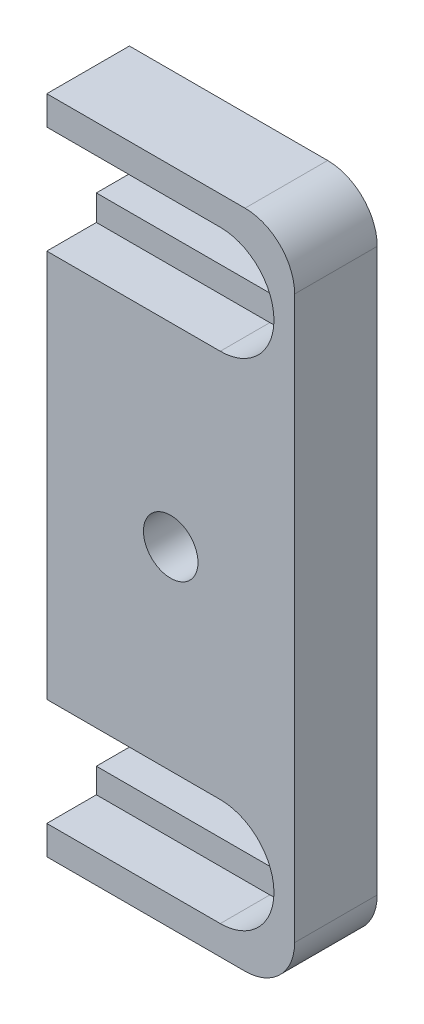
from build123d import *

# Parameters (mm, degrees)
SKETCH1_W             = 15
SKETCH1_H             = 40
BOSS_EXTRUDE1_DEPTH   = 5
CUT_EXTRUDE1_DEPTH    = 3
CUT_EXTRUDE2_DEPTH    = 43.825226211
CUT_EXTRUDE3_DEPTH    = 3
CUT_EXTRUDE4_DEPTH    = 44.011626335
M4X0_7_TAPPED_HOLE1_D = 3.3
FILLET1_R             = 3


with BuildPart() as part:
    # Sketch1 → Boss-Extrude1 (new body)
    with BuildSketch(Plane.XY.offset(5)):
        with Locations((7.5, -20)):
            Rectangle(SKETCH1_W, SKETCH1_H)
    extrude(amount=-BOSS_EXTRUDE1_DEPTH)

    # Sketch2 → Cut-Extrude1 (cut)
    with BuildSketch(Plane.XY.offset(5)):
        with BuildLine():
            Line((0, -8.25), (10.5, -8.25))
            ThreePointArc((10.5, -8.25), (13.75, -5), (10.5, -1.75))
            Line((10.5, -1.75), (0, -1.75))
            Line((0, -1.75), (0, -8.25))
        make_face()
    extrude(amount=-CUT_EXTRUDE1_DEPTH, mode=Mode.SUBTRACT)

    # Sketch3 → Cut-Extrude2 (cut, through all)
    with BuildSketch(Plane.XY.offset(2)):
        with BuildLine():
            Line((0, -3.3), (0, -6.7))
            Line((0, -6.7), (10.5, -6.7))
            ThreePointArc((10.5, -6.7), (12.2, -5), (10.5, -3.3))
            Line((10.5, -3.3), (0, -3.3))
        make_face()
    extrude(amount=-CUT_EXTRUDE2_DEPTH, mode=Mode.SUBTRACT)

    # Sketch4 → Cut-Extrude3 (cut)
    with BuildSketch(Plane.XY.offset(5)):
        with BuildLine():
            Line((10.5, -31.75), (0, -31.75))
            Line((0, -31.75), (0, -38.25))
            Line((0, -38.25), (10.5, -38.25))
            ThreePointArc((10.5, -38.25), (13.75, -35), (10.5, -31.75))
        make_face()
    extrude(amount=-CUT_EXTRUDE3_DEPTH, mode=Mode.SUBTRACT)

    # Sketch5 → Cut-Extrude4 (cut, through all)
    with BuildSketch(Plane(origin=(0, 0, 0), x_dir=(-1, 0, 0), z_dir=(0, 0, -1))):
        with BuildLine():
            Line((0, -36.75), (0, -33.25))
            Line((0, -33.25), (-10.5, -33.25))
            ThreePointArc((-10.5, -33.25), (-12.25, -35), (-10.5, -36.75))
            Line((-10.5, -36.75), (0, -36.75))
        make_face()
    extrude(amount=-CUT_EXTRUDE4_DEPTH, mode=Mode.SUBTRACT)

    # M4x0.7 Tapped Hole1 (through all)
    with Locations(Plane.XY.offset(5)):
        with Locations((7.5, -20)):
            Hole(M4X0_7_TAPPED_HOLE1_D / 2)

    # Fillet1
    fillet1_edges = [part.edges().sort_by_distance(p)[0] for p in [
        (15, -40, 2.5),
        (15, 0, 2.5),
    ]]
    fillet(fillet1_edges, radius=FILLET1_R)


solid = part.part
